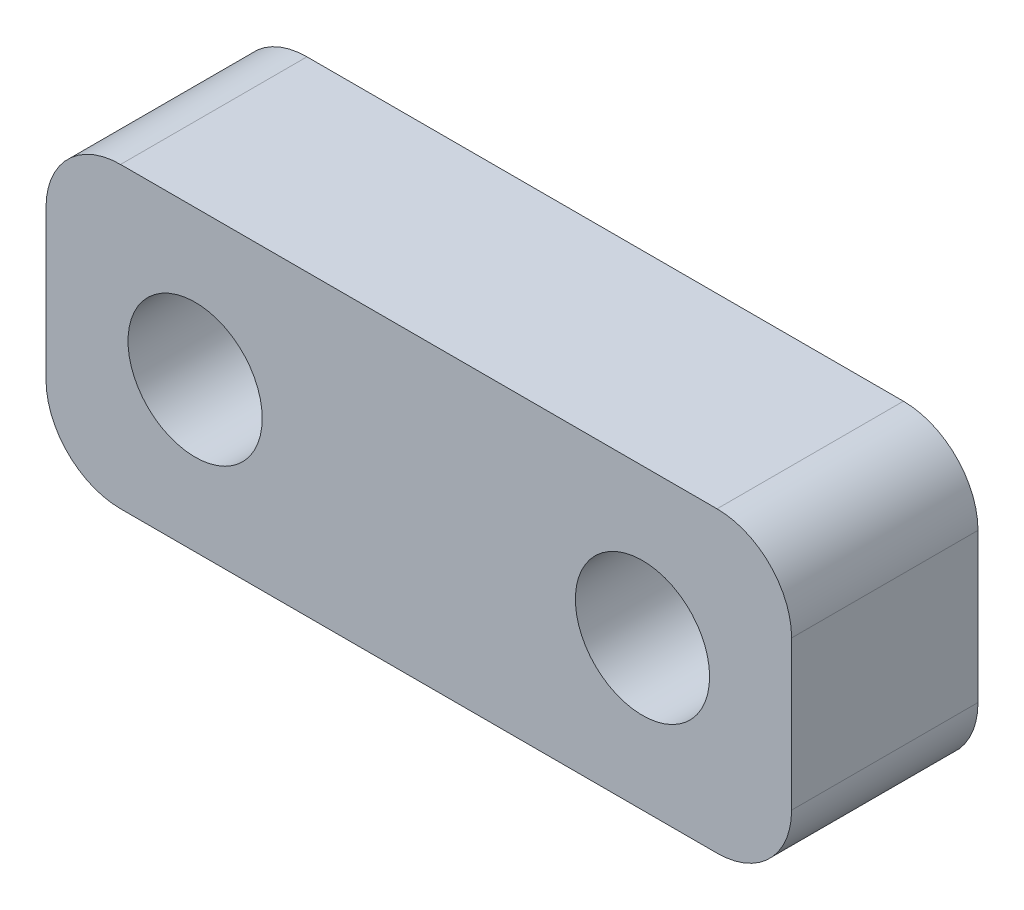
from build123d import *

# Parameters (mm, degrees)
SKETCH2_W            = 20
SKETCH2_H            = 8
BOSS_EXTRUDE1_DEPTH  = 5
M3_CLEARANCE_HOLE1_D = 3.6
FILLET1_R            = 2


with BuildPart() as part:
    # Sketch2 → Boss-Extrude1 (new body)
    with BuildSketch(Plane.XY):
        with Locations((10, 4)):
            Rectangle(SKETCH2_W, SKETCH2_H)
    extrude(amount=BOSS_EXTRUDE1_DEPTH)

    # M3 Clearance Hole1 (through all)
    with Locations(Plane.XY.offset(5)):
        with Locations((4, 4), (16, 4)):
            Hole(M3_CLEARANCE_HOLE1_D / 2)

    # Fillet1
    fillet1_edges = [part.edges().sort_by_distance(p)[0] for p in [
        (0, 8, 2.5),
        (20, 8, 2.5),
        (20, 0, 2.5),
        (0, 0, 2.5),
    ]]
    fillet(fillet1_edges, radius=FILLET1_R)


solid = part.part
